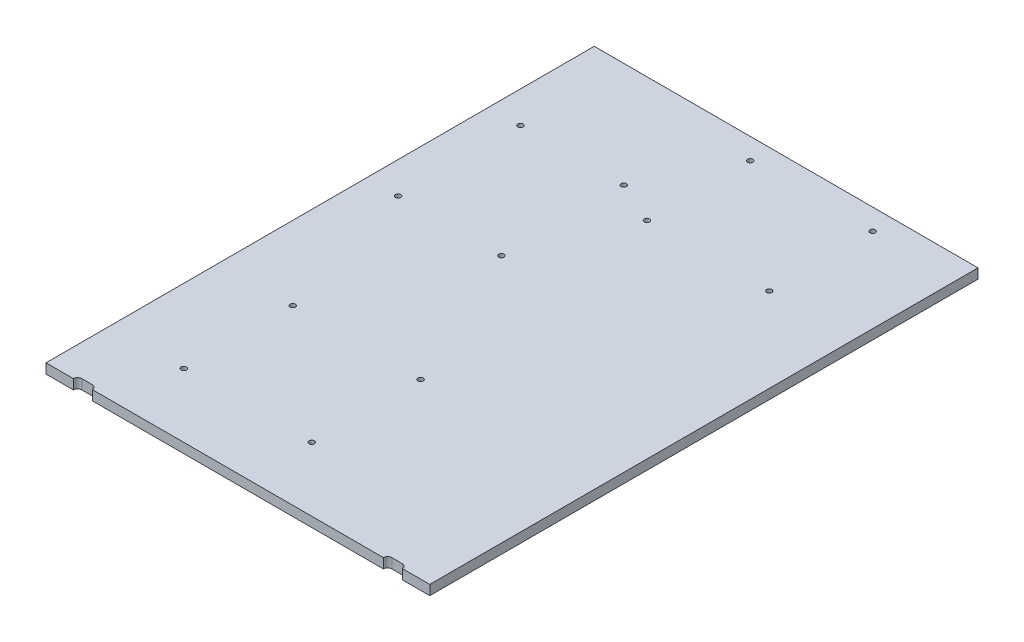
from build123d import *

# Parameters (mm, degrees)
SKETCH_1_W          = 182
SKETCH_1_H          = 260
EXTRUDE_1_DEPTH     = 4.65
CUT_EXTRUDE_1_REACH = 319.405
PCB_REACH           = 319.405
SKETCH_3_R          = 1.25


with BuildPart() as part:
    # 草图1 → 凸台-拉伸1 (new body)
    with BuildSketch(Plane(origin=(0, 0, 0), x_dir=(1, 0, 0), z_dir=(0, 1, 0))):
        with Locations((91, 130)):
            Rectangle(SKETCH_1_W, SKETCH_1_H)
    extrude(amount=EXTRUDE_1_DEPTH)

    # 草图2 → 切除-拉伸1 (cut, up to next)
    with BuildSketch(Plane(origin=(0, 4.65, 0), x_dir=(1, 0, 0), z_dir=(0, 1, 0)), mode=Mode.PRIVATE) as cut_extrude_1_sk1:
        with BuildLine():
            Line((15, 2), (20, 2))
            ThreePointArc((20, 2), (21.414213562, 1.414213562), (22, 0))
            Line((22, 0), (13, 0))
            ThreePointArc((13, 0), (13.585786438, 1.414213562), (15, 2))
        make_face()
    cut_extrude_1_tool1 = extrude(cut_extrude_1_sk1.sketch, amount=-CUT_EXTRUDE_1_REACH, mode=Mode.PRIVATE) & part.part
    # 草图2 → 切除-拉伸1 (cut, up to next)
    with BuildSketch(Plane(origin=(0, 4.65, 0), x_dir=(1, 0, 0), z_dir=(0, 1, 0)), mode=Mode.PRIVATE) as cut_extrude_1_sk2:
        with BuildLine():
            Line((162, 2), (167, 2))
            ThreePointArc((167, 2), (168.414213562, 1.414213562), (169, 0))
            Line((169, 0), (160, 0))
            ThreePointArc((160, 0), (160.585786438, 1.414213562), (162, 2))
        make_face()
    cut_extrude_1_tool2 = extrude(cut_extrude_1_sk2.sketch, amount=-CUT_EXTRUDE_1_REACH, mode=Mode.PRIVATE) & part.part
    add(cut_extrude_1_tool1.solids().sort_by_distance((17.5, 4.65, -0.941667))[0], mode=Mode.SUBTRACT)
    add(cut_extrude_1_tool2.solids().sort_by_distance((164.5, 4.65, -0.941667))[0], mode=Mode.SUBTRACT)

    # 草图3 → pcb (cut, up to next)
    with BuildSketch(Plane(origin=(0, 4.65, 0), x_dir=(1, 0, 0), z_dir=(0, 1, 0)), mode=Mode.PRIVATE) as pcb_sk1:
        with Locations(Location((35, 30.36, 0), (0, 0, 270))):
            Circle(SKETCH_3_R)
    pcb_tool1 = extrude(pcb_sk1.sketch, amount=-PCB_REACH, mode=Mode.PRIVATE) & part.part
    # 草图3 → pcb (cut, up to next)
    with BuildSketch(Plane(origin=(0, 4.65, 0), x_dir=(1, 0, 0), z_dir=(0, 1, 0)), mode=Mode.PRIVATE) as pcb_sk2:
        with Locations(Location((95.65, 30.36, 0), (0, 0, 270))):
            Circle(SKETCH_3_R)
    pcb_tool2 = extrude(pcb_sk2.sketch, amount=-PCB_REACH, mode=Mode.PRIVATE) & part.part
    # 草图3 → pcb (cut, up to next)
    with BuildSketch(Plane(origin=(0, 4.65, 0), x_dir=(1, 0, 0), z_dir=(0, 1, 0)), mode=Mode.PRIVATE) as pcb_sk3:
        with Locations(Location((35, 82, 0), (0, 0, 270))):
            Circle(SKETCH_3_R)
    pcb_tool3 = extrude(pcb_sk3.sketch, amount=-PCB_REACH, mode=Mode.PRIVATE) & part.part
    # 草图3 → pcb (cut, up to next)
    with BuildSketch(Plane(origin=(0, 4.65, 0), x_dir=(1, 0, 0), z_dir=(0, 1, 0)), mode=Mode.PRIVATE) as pcb_sk4:
        with Locations(Location((95.65, 82, 0), (0, 0, 270))):
            Circle(SKETCH_3_R)
    pcb_tool4 = extrude(pcb_sk4.sketch, amount=-PCB_REACH, mode=Mode.PRIVATE) & part.part
    # 草图3 → pcb (cut, up to next)
    with BuildSketch(Plane(origin=(0, 4.65, 0), x_dir=(1, 0, 0), z_dir=(0, 1, 0)), mode=Mode.PRIVATE) as pcb_sk5:
        with Locations(Location((15, 210, 0), (0, 0, 270))):
            Circle(SKETCH_3_R)
    pcb_tool5 = extrude(pcb_sk5.sketch, amount=-PCB_REACH, mode=Mode.PRIVATE) & part.part
    # 草图3 → pcb (cut, up to next)
    with BuildSketch(Plane(origin=(0, 4.65, 0), x_dir=(1, 0, 0), z_dir=(0, 1, 0)), mode=Mode.PRIVATE) as pcb_sk6:
        with Locations(Location((64, 210, 0), (0, 0, 270))):
            Circle(SKETCH_3_R)
    pcb_tool6 = extrude(pcb_sk6.sketch, amount=-PCB_REACH, mode=Mode.PRIVATE) & part.part
    # 草图3 → pcb (cut, up to next)
    with BuildSketch(Plane(origin=(0, 4.65, 0), x_dir=(1, 0, 0), z_dir=(0, 1, 0)), mode=Mode.PRIVATE) as pcb_sk7:
        with Locations(Location((64, 152, 0), (0, 0, 270))):
            Circle(SKETCH_3_R)
    pcb_tool7 = extrude(pcb_sk7.sketch, amount=-PCB_REACH, mode=Mode.PRIVATE) & part.part
    # 草图3 → pcb (cut, up to next)
    with BuildSketch(Plane(origin=(0, 4.65, 0), x_dir=(1, 0, 0), z_dir=(0, 1, 0)), mode=Mode.PRIVATE) as pcb_sk8:
        with Locations(Location((15, 152, 0), (0, 0, 270))):
            Circle(SKETCH_3_R)
    pcb_tool8 = extrude(pcb_sk8.sketch, amount=-PCB_REACH, mode=Mode.PRIVATE) & part.part
    # 草图3 → pcb (cut, up to next)
    with BuildSketch(Plane(origin=(0, 4.65, 0), x_dir=(1, 0, 0), z_dir=(0, 1, 0)), mode=Mode.PRIVATE) as pcb_sk9:
        with Locations(Location((84, 250, 0), (0, 0, 270))):
            Circle(SKETCH_3_R)
    pcb_tool9 = extrude(pcb_sk9.sketch, amount=-PCB_REACH, mode=Mode.PRIVATE) & part.part
    # 草图3 → pcb (cut, up to next)
    with BuildSketch(Plane(origin=(0, 4.65, 0), x_dir=(1, 0, 0), z_dir=(0, 1, 0)), mode=Mode.PRIVATE) as pcb_sk10:
        with Locations(Location((142, 250, 0), (0, 0, 270))):
            Circle(SKETCH_3_R)
    pcb_tool10 = extrude(pcb_sk10.sketch, amount=-PCB_REACH, mode=Mode.PRIVATE) & part.part
    # 草图3 → pcb (cut, up to next)
    with BuildSketch(Plane(origin=(0, 4.65, 0), x_dir=(1, 0, 0), z_dir=(0, 1, 0)), mode=Mode.PRIVATE) as pcb_sk11:
        with Locations(Location((84, 201, 0), (0, 0, 270))):
            Circle(SKETCH_3_R)
    pcb_tool11 = extrude(pcb_sk11.sketch, amount=-PCB_REACH, mode=Mode.PRIVATE) & part.part
    # 草图3 → pcb (cut, up to next)
    with BuildSketch(Plane(origin=(0, 4.65, 0), x_dir=(1, 0, 0), z_dir=(0, 1, 0)), mode=Mode.PRIVATE) as pcb_sk12:
        with Locations(Location((142, 201, 0), (0, 0, 270))):
            Circle(SKETCH_3_R)
    pcb_tool12 = extrude(pcb_sk12.sketch, amount=-PCB_REACH, mode=Mode.PRIVATE) & part.part
    add(pcb_tool1.solids().sort_by_distance((35, 4.65, -30.36))[0], mode=Mode.SUBTRACT)
    add(pcb_tool2.solids().sort_by_distance((95.65, 4.65, -30.36))[0], mode=Mode.SUBTRACT)
    add(pcb_tool3.solids().sort_by_distance((35, 4.65, -82))[0], mode=Mode.SUBTRACT)
    add(pcb_tool4.solids().sort_by_distance((95.65, 4.65, -82))[0], mode=Mode.SUBTRACT)
    add(pcb_tool5.solids().sort_by_distance((15, 4.65, -210))[0], mode=Mode.SUBTRACT)
    add(pcb_tool6.solids().sort_by_distance((64, 4.65, -210))[0], mode=Mode.SUBTRACT)
    add(pcb_tool7.solids().sort_by_distance((64, 4.65, -152))[0], mode=Mode.SUBTRACT)
    add(pcb_tool8.solids().sort_by_distance((15, 4.65, -152))[0], mode=Mode.SUBTRACT)
    add(pcb_tool9.solids().sort_by_distance((84, 4.65, -250))[0], mode=Mode.SUBTRACT)
    add(pcb_tool10.solids().sort_by_distance((142, 4.65, -250))[0], mode=Mode.SUBTRACT)
    add(pcb_tool11.solids().sort_by_distance((84, 4.65, -201))[0], mode=Mode.SUBTRACT)
    add(pcb_tool12.solids().sort_by_distance((142, 4.65, -201))[0], mode=Mode.SUBTRACT)


solid = part.part
